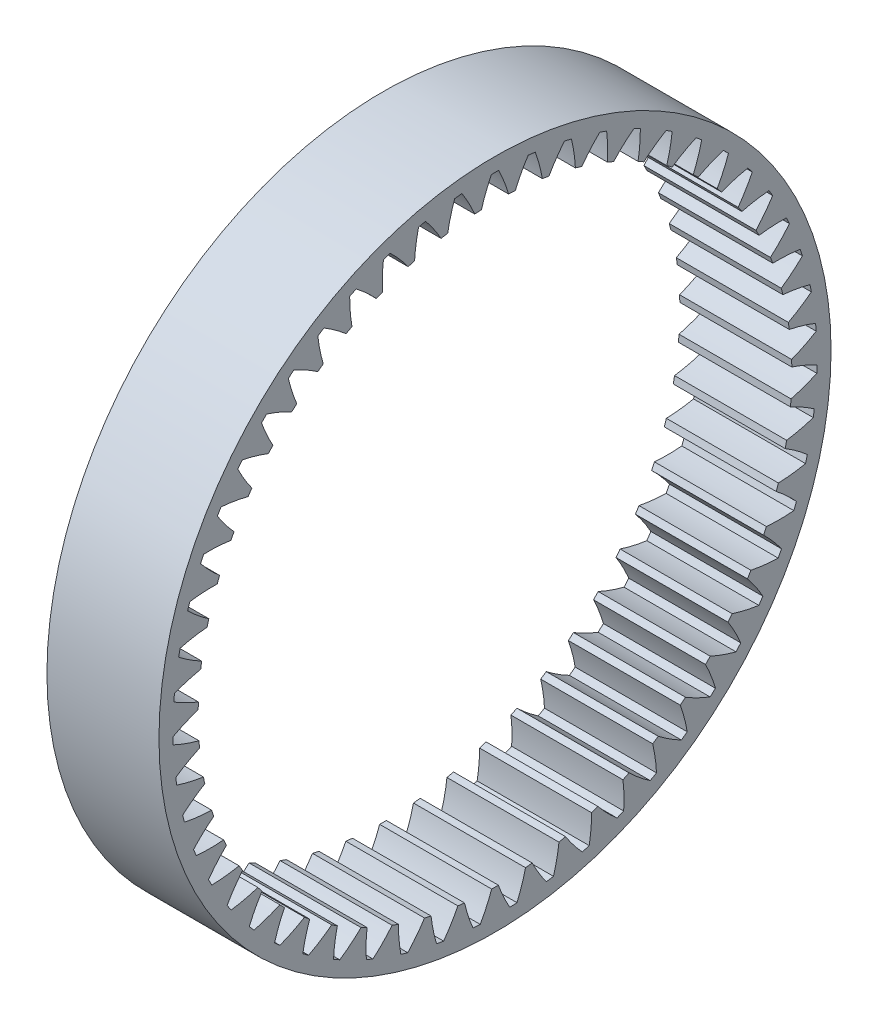
from build123d import *

# Parameters (mm, degrees)
BASPROSKE_W     = 15
BASPROSKE_H     = 5.25
TOOTHCUT_DEPTH  = 66.383484153
TEETHCUTS_COUNT = 55
TEETHCUTS_ANGLE = 353.454545455


with BuildPart() as part:
    # BasProSke → Base-Revolve (revolve)
    with BuildSketch(Plane(origin=(0, 0, 0), x_dir=(1, 0, 0), z_dir=(0, 1, 0)), mode=Mode.PRIVATE) as base_revolve_sk:
        with Locations((7.5, 42.375)):
            Rectangle(BASPROSKE_W, BASPROSKE_H)
    revolve(base_revolve_sk.sketch.rotate(Axis((-10, 0, 0), (1, 0, 0)), 180), axis=Axis((-10, 0, 0), (1, 0, 0)))

    # TooCutSke → ToothCut (cut, through all)
    with BuildSketch(Plane(origin=(0, 0, 0), x_dir=(0, 0, -1), z_dir=(1, 0, 0))):
        with BuildLine():
            ThreePointArc((1.828056403, 39.682515734), (1.231845324, 41.433137251), (0.481217477, 43.123315106))
            ThreePointArc((0.481217477, 43.123315106), (0, 43.126), (-0.481217477, 43.123315106))
            ThreePointArc((-0.481217477, 43.123315106), (-1.231845324, 41.433137251), (-1.828056403, 39.682515734))
            ThreePointArc((-1.828056403, 39.682515734), (0, 39.7246), (1.828056403, 39.682515734))
        make_face()
    toothcut = extrude(amount=TOOTHCUT_DEPTH, mode=Mode.SUBTRACT)

    # TeethCuts: ToothCut ×55 about axis
    teethcuts_axis = Axis((-10, 0, 0), (1, 0, 0))
    for i in range(1, TEETHCUTS_COUNT):
        add(toothcut.rotate(teethcuts_axis, i * TEETHCUTS_ANGLE / (TEETHCUTS_COUNT - 1)), mode=Mode.SUBTRACT)


solid = part.part
